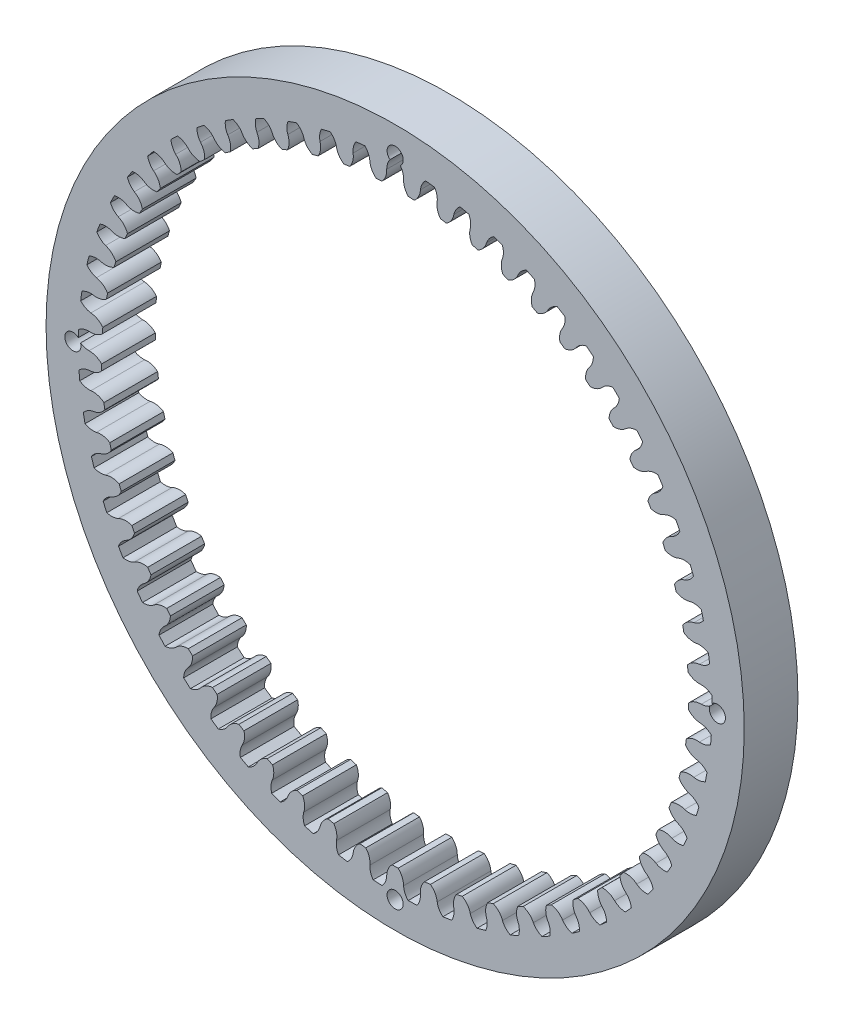
from build123d import *

# Parameters (mm, degrees)
CROQUIS1_R              = 65
CROQUIS1_R_2            = 54.665
SALIENTE_EXTRUIR1_DEPTH = 10
CORTAR_EXTRUIR1_DEPTH   = 93.466210045
MATRIZC1_COUNT          = 57
CROQUIS3_R              = 1.5
CORTAR_EXTRUIR2_DEPTH   = 93.466210045


with BuildPart() as part:
    # Croquis1 → Saliente-Extruir1 (new body)
    with BuildSketch(Plane.XY):
        Circle(CROQUIS1_R)
        Circle(CROQUIS1_R_2, mode=Mode.SUBTRACT)
    extrude(amount=SALIENTE_EXTRUIR1_DEPTH)

    # Croquis2 → Cortar-Extruir1 (cut, through all)
    with BuildSketch(Plane.XY.offset(10)):
        with BuildLine():
            ThreePointArc((2.460748689, 54.609586529), (0, 54.665), (-2.460748689, 54.609586529))
            ThreePointArc((-2.460748689, 54.609586529), (-1.766163967, 55.700268245), (-1.57, 56.978373968))
            ThreePointArc((-1.57, 56.978373968), (-1.381230853, 58.050678241), (-0.837620093, 58.994053875))
            ThreePointArc((-0.837620093, 58.994053875), (0, 59), (0.837620093, 58.994053875))
            ThreePointArc((0.837620093, 58.994053875), (1.381230853, 58.050678241), (1.57, 56.978373968))
            ThreePointArc((1.57, 56.978373968), (1.766163967, 55.700268245), (2.460748689, 54.609586529))
        make_face()
    cortar_extruir1 = extrude(amount=-CORTAR_EXTRUIR1_DEPTH, mode=Mode.SUBTRACT)

    # MatrizC1: Cortar-Extruir1 ×57 about axis
    matrizc1_axis = Axis((0, 0, 0), (0, 0, 1))
    for i in range(1, MATRIZC1_COUNT):
        add(cortar_extruir1.rotate(matrizc1_axis, i * 360 / MATRIZC1_COUNT), mode=Mode.SUBTRACT)

    # Croquis3 → Cortar-Extruir2 (cut, through all)
    with BuildSketch(Plane.XY.offset(10)):
        with Locations((0.002, 59.999670843)):
            Circle(CROQUIS3_R)
        with Locations((60.000670843, -0.001)):
            Circle(CROQUIS3_R)
        with Locations((0, -59.999670843)):
            Circle(CROQUIS3_R)
        with Locations((-59.998670843, 0.001)):
            Circle(CROQUIS3_R)
    extrude(amount=-CORTAR_EXTRUIR2_DEPTH, mode=Mode.SUBTRACT)


solid = part.part
